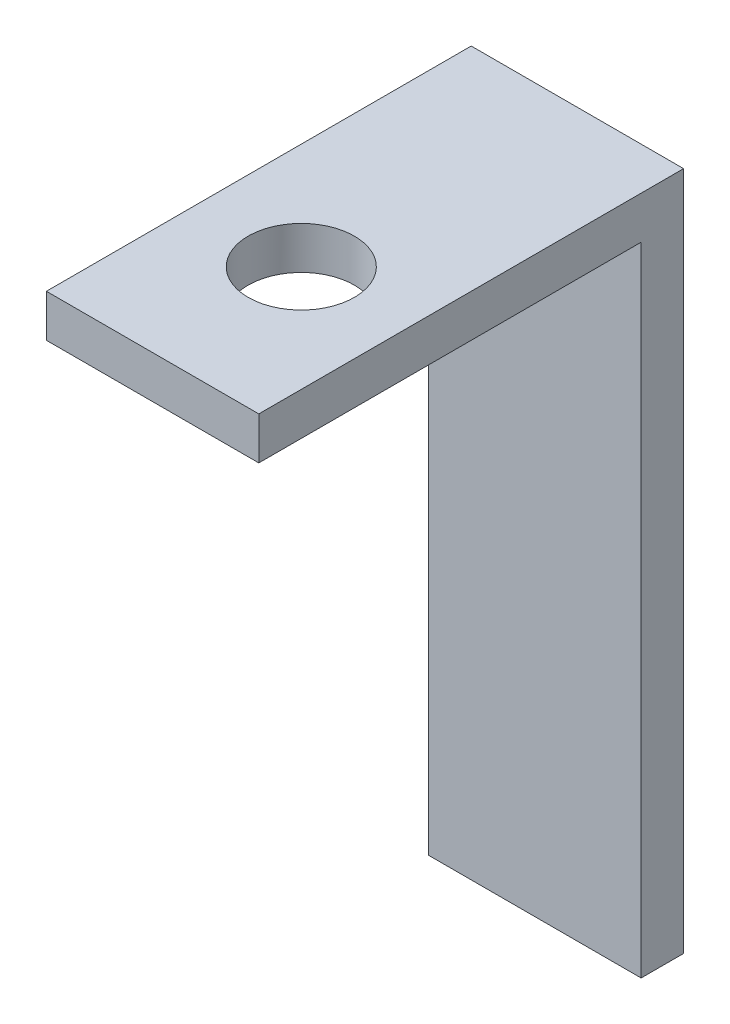
from build123d import *

# Parameters (mm, degrees)
SKETCH1_W           = 10
SKETCH1_H           = 32
BOSS_EXTRUDE1_DEPTH = 2
SKETCH2_W           = 10
SKETCH2_H           = 2
BOSS_EXTRUDE2_DEPTH = 18
SKETCH3_R           = 2.5
CUT_EXTRUDE1_DEPTH  = 2


with BuildPart() as part:
    # Sketch1 → Boss-Extrude1 (new body)
    with BuildSketch(Plane.XY):
        Rectangle(SKETCH1_W, SKETCH1_H)
    extrude(amount=BOSS_EXTRUDE1_DEPTH)

    # Sketch2 → Boss-Extrude2 (add)
    with BuildSketch(Plane.XY.offset(2)):
        with Locations((0, 15)):
            Rectangle(SKETCH2_W, SKETCH2_H)
    extrude(amount=BOSS_EXTRUDE2_DEPTH)

    # Sketch3 → Cut-Extrude1 (cut)
    with BuildSketch(Plane(origin=(0, 16, 0), x_dir=(1, 0, 0), z_dir=(0, 1, 0))):
        with Locations(Location((0, -13, 0), (0, 0, 270))):
            Circle(SKETCH3_R)
    extrude(amount=-CUT_EXTRUDE1_DEPTH, mode=Mode.SUBTRACT)


solid = part.part
